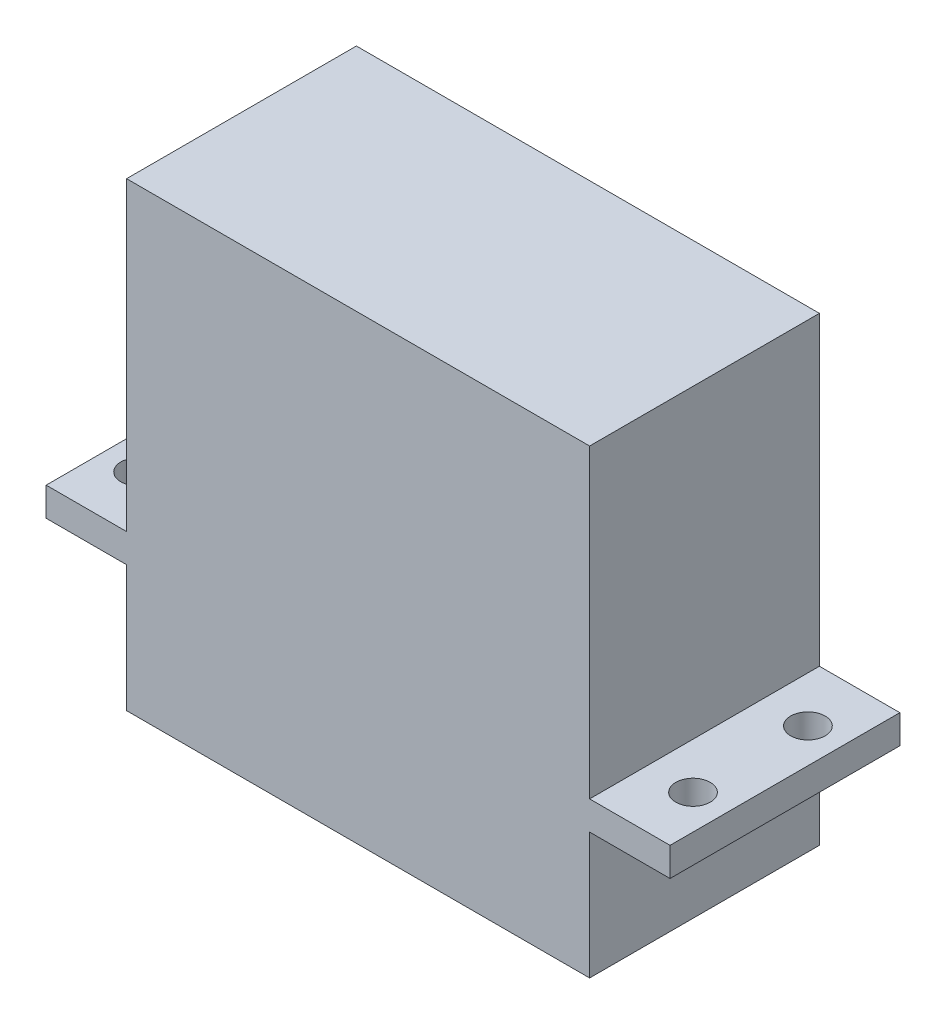
from build123d import *

# Parameters (mm, degrees)
SKETCH1_W           = 40.3
SKETCH1_H           = 20
BOSS_EXTRUDE1_DEPTH = 40.1
SKETCH2_W           = 20
SKETCH2_H           = 2.5
BOSS_EXTRUDE2_DEPTH = 7
SKETCH3_W           = 20
SKETCH3_H           = 2.5
BOSS_EXTRUDE3_DEPTH = 7
SKETCH4_R           = 1.5
CUT_EXTRUDE1_DEPTH  = 7
SKETCH5_R           = 3
BOSS_EXTRUDE4_DEPTH = 3.5


with BuildPart() as part:
    # Sketch1 → Boss-Extrude1 (new body)
    with BuildSketch(Plane(origin=(0, 0, 0), x_dir=(1, 0, 0), z_dir=(0, 1, 0))):
        Rectangle(SKETCH1_W, SKETCH1_H)
    extrude(amount=BOSS_EXTRUDE1_DEPTH)

    # Sketch2 → Boss-Extrude2 (add)
    with BuildSketch(Plane(origin=(20.15, 0, 0), x_dir=(0, 0, -1), z_dir=(1, 0, 0))):
        with Locations((0, 12.25)):
            Rectangle(SKETCH2_W, SKETCH2_H)
    extrude(amount=BOSS_EXTRUDE2_DEPTH)

    # Sketch3 → Boss-Extrude3 (add)
    with BuildSketch(Plane.ZY.offset(20.15)):
        with Locations((0, 12.25)):
            Rectangle(SKETCH3_W, SKETCH3_H)
    extrude(amount=BOSS_EXTRUDE3_DEPTH)

    # Sketch4 → Cut-Extrude1 (cut)
    with BuildSketch(Plane.XZ.offset(-11)):
        with Locations((-24.15, 5)):
            Circle(SKETCH4_R)
        with Locations((-24.15, -5)):
            Circle(SKETCH4_R)
        with Locations((24.15, 5)):
            Circle(SKETCH4_R)
        with Locations((24.15, -5)):
            Circle(SKETCH4_R)
    extrude(amount=-CUT_EXTRUDE1_DEPTH, mode=Mode.SUBTRACT)

    # Sketch5 → Boss-Extrude4 (add)
    with BuildSketch(Plane.XZ):
        with Locations((11.15, 0)):
            Circle(SKETCH5_R)
    extrude(amount=BOSS_EXTRUDE4_DEPTH)


solid = part.part
